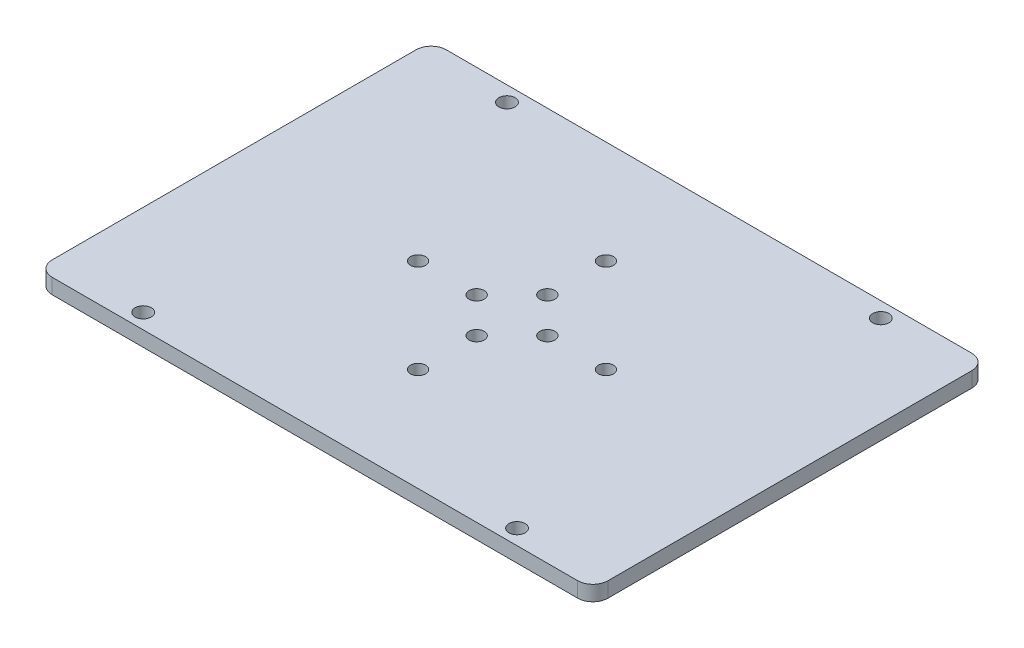
from build123d import *

# Parameters (mm, degrees)
SKETCH_1_W          = 110
SKETCH_1_H          = 78
SKETCH_1_R          = 1.6
EXTRUDE_1_DEPTH     = 3
FILLET_1_R          = 3
SKETCH_2_R          = 1.5
CUT_EXTRUDE_1_DEPTH = 10


with BuildPart() as part:
    # 草图1 → 凸台-拉伸1 (new body)
    with BuildSketch(Plane(origin=(0, 0, 0), x_dir=(1, 0, 0), z_dir=(0, 1, 0))):
        Rectangle(SKETCH_1_W, SKETCH_1_H)
        with Locations(Location((-37, 36, 0), (0, 0, 270))):
            Circle(SKETCH_1_R, mode=Mode.SUBTRACT)
        with Locations(Location((37, 36, 0), (0, 0, 270))):
            Circle(SKETCH_1_R, mode=Mode.SUBTRACT)
        with Locations(Location((37, -36, 0), (0, 0, 270))):
            Circle(SKETCH_1_R, mode=Mode.SUBTRACT)
        with Locations(Location((-37, -36, 0), (0, 0, 270))):
            Circle(SKETCH_1_R, mode=Mode.SUBTRACT)
    extrude(amount=EXTRUDE_1_DEPTH)

    # 圆角1
    fillet_1_edges = [part.edges().sort_by_distance(p)[0] for p in [
        (-55, 1.5, -39),
        (55, 1.5, -39),
        (55, 1.5, 39),
        (-55, 1.5, 39),
    ]]
    fillet(fillet_1_edges, radius=FILLET_1_R)

    # 草图2 → 切除-拉伸1 (cut)
    with BuildSketch(Plane(origin=(0, 3, 0), x_dir=(1, 0, 0), z_dir=(0, 1, 0))):
        with Locations(Location((0, 7, 0), (0, 0, 270))):
            Circle(SKETCH_2_R)
        with Locations(Location((7, 0, 0), (0, 0, 270))):
            Circle(SKETCH_2_R)
        with Locations(Location((0, -7, 0), (0, 0, 270))):
            Circle(SKETCH_2_R)
        with Locations(Location((-7, 0, 0), (0, 0, 270))):
            Circle(SKETCH_2_R)
        with Locations(Location((18.6, 0, 0), (0, 0, 270))):
            Circle(SKETCH_2_R)
        with Locations(Location((-18.6, 0, 0), (0, 0, 270))):
            Circle(SKETCH_2_R)
        with Locations(Location((0, 18.6, 0), (0, 0, 270))):
            Circle(SKETCH_2_R)
        with Locations(Location((0, -18.6, 0), (0, 0, 270))):
            Circle(SKETCH_2_R)
    extrude(amount=-CUT_EXTRUDE_1_DEPTH, mode=Mode.SUBTRACT)


solid = part.part
